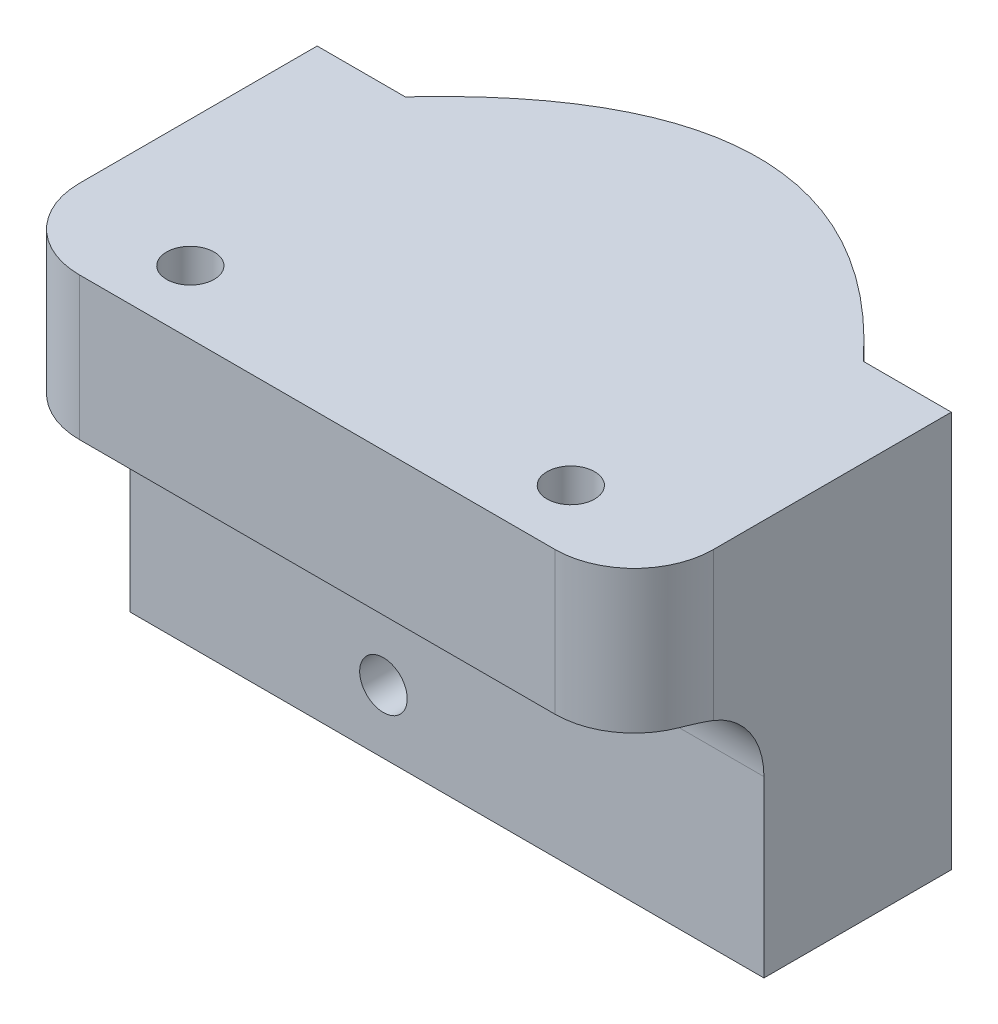
from build123d import *
from build123d.topology import SkipClean

# Parameters (mm, degrees)
BOSS_EXTRUDE1_DEPTH     = 25
SKETCH2_W               = 40
SKETCH2_H               = 9
BOSS_EXTRUDE2_DEPTH     = 8.18
FILLET1_R               = 5
CUT_EXTRUDE1_DEPTH      = 47.874168161
CUT_EXTRUDE1_DEPTH_BACK = 47.874168161
SKETCH3_R               = 1.5
SKETCH3_4_R             = 4
CUT_EXTRUDE6_DEPTH      = 47.874168161
SKETCH6_R               = 1.5
CUT_EXTRUDE7_DEPTH      = 48.026142101
CUT_EXTRUDE8_START      = -9
SKETCH6_3_R             = 4
CUT_EXTRUDE8_DEPTH      = 40
FILLET2_R               = 5


with BuildPart() as part:
    # Sketch1 → Boss-Extrude1 (new body)
    with BuildSketch(Plane(origin=(0, 0, 0), x_dir=(1, 0, 0), z_dir=(0, 1, 0))):
        with BuildLine():
            add(Edge.make_bspline(
                [(0, 0), (14.445, 15.64), (28.89, 0)],
                knots=[0, 0, 0, 1, 1, 1], degree=2))
            Line((28.89, 0), (0, 0))
        make_face()
        Polygon((-5.555, -11.82), (34.445, -11.82), (34.445, 0), (28.89, 0), (0, 0), (-5.555, 0), align=None)
    extrude(amount=BOSS_EXTRUDE1_DEPTH)

    # Sketch2 → Boss-Extrude2 (add)
    with BuildSketch(Plane.XY.offset(11.82)):
        with Locations((14.445, 20.5)):
            Rectangle(SKETCH2_W, SKETCH2_H)
    extrude(amount=BOSS_EXTRUDE2_DEPTH)

    # Fillet1
    fillet1_edges = [part.edges().sort_by_distance(p)[0] for p in [
        (14.445, 16, 11.82),
    ]]
    fillet(fillet1_edges, radius=FILLET1_R)

    # Sketch3 → Cut-Extrude1 (cut, two sides: drawn at the far end of the back side and taken through both)
    with BuildSketch(Plane.XY.offset(11.82).offset(-CUT_EXTRUDE1_DEPTH_BACK)):
        with Locations((18.445, 12)):
            Circle(SKETCH3_R)
        with Locations((10.445, 4)):
            Circle(SKETCH3_R)
    extrude(amount=CUT_EXTRUDE1_DEPTH + CUT_EXTRUDE1_DEPTH_BACK, mode=Mode.SUBTRACT)

    # Sketch3<4> → Cut-Extrude6 (cut, through all)
    with SkipClean():  # the faces are left unmerged after this step: merging them gives an invalid solid
        with BuildSketch(Plane.XY.offset(11.82)):
            with Locations((18.445, 12)):
                Circle(SKETCH3_4_R)
        extrude(amount=CUT_EXTRUDE6_DEPTH, mode=Mode.SUBTRACT)

    # Sketch6 → Cut-Extrude7 (cut, through all)
    with SkipClean():  # the faces are left unmerged after this step: merging them gives an invalid solid
        with BuildSketch(Plane(origin=(0, 25, 0), x_dir=(1, 0, 0), z_dir=(0, 1, 0))):
            with Locations(Location((2.445, -16, 0), (0, 0, 270))):
                Circle(SKETCH6_R)
            with Locations(Location((26.445, -16, 0), (0, 0, 270))):
                Circle(SKETCH6_R)
        extrude(amount=-CUT_EXTRUDE7_DEPTH, mode=Mode.SUBTRACT)

    # Sketch6<3> → Cut-Extrude8 (cut)
    with SkipClean():  # the faces are left unmerged after this step: merging them gives an invalid solid
        with BuildSketch(Plane(origin=(0, 25, 0), x_dir=(1, 0, 0), z_dir=(0, 1, 0)).offset(CUT_EXTRUDE8_START)):
            with Locations((2.445, -16)):
                Circle(SKETCH6_3_R)
            with Locations((26.445, -16)):
                Circle(SKETCH6_3_R)
        extrude(amount=-CUT_EXTRUDE8_DEPTH, mode=Mode.SUBTRACT)

    # Fillet2
    fillet2_edges = [part.edges().sort_by_distance(p)[0] for p in [
        (34.445, 20.5, 20),
        (-5.555, 20.5, 20),
    ]]
    fillet(fillet2_edges, radius=FILLET2_R)


solid = part.part
